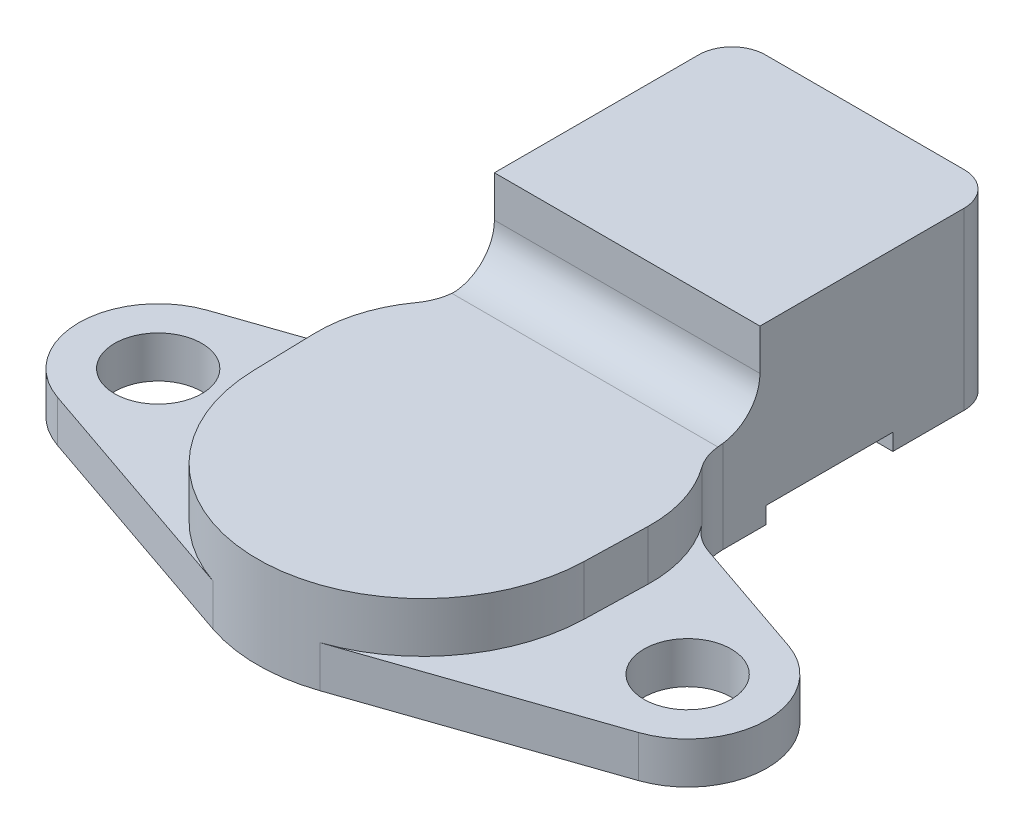
from build123d import *

# Parameters (mm, degrees)
BOSS_EXTRUDE1_DEPTH   = 1
SKETCH3_R             = 2.6162
BOSS_EXTRUDE1_2_DEPTH = 1
SKETCH4_R             = 2.6162
BOSS_EXTRUDE2_DEPTH   = 1.5
BOSS_EXTRUDE3_DEPTH   = 3
SKETCH6_W             = 15.9258
SKETCH6_H             = 13.25
BOSS_EXTRUDE4_DEPTH   = 5
SKETCH7_W             = 13.5128
SKETCH7_H             = 10
CUT_EXTRUDE1_DEPTH    = 5
FILLET1_R             = 2.54
FILLET2_R             = 2.54
FILLET3_R             = 7.62
FILLET5_R             = 2.54
SKETCH8_W             = 15.9258
SKETCH8_H             = 10.5
CUT_EXTRUDE2_DEPTH    = 3
BOSS_EXTRUDE5_DEPTH   = 4
SKETCH10_W            = 0.6964
SKETCH10_H            = 7.5
BOSS_EXTRUDE6_DEPTH   = 2
FILLET8_R             = 2


with BuildPart() as part:
    # Sketch3 → Boss-Extrude1 (new body)
    with BuildSketch(Plane(origin=(0, 0, 0), x_dir=(1, 0, 0), z_dir=(0, 1, 0))):
        Polygon((6.7564, 24.25), (6.7564, 20.22), (7.9629, 20.22), (7.9629, 25.5), (-7.9629, 25.5), (-7.9629, 20.22), (-6.7564, 20.22), (-6.7564, 24.25), align=None)
    extrude(amount=BOSS_EXTRUDE1_DEPTH)



with BuildPart() as body_2:
    # Sketch3 → Boss-Extrude1 2 (new body)
    with BuildSketch(Plane(origin=(0, 0, 0), x_dir=(1, 0, 0), z_dir=(0, 1, 0))):
        with BuildLine():
            Line((6.7564, 12.6), (6.7564, 4.876812672))
            ThreePointArc((6.7564, 4.876812672), (6.776225919, 4.847421317), (6.796505263, 4.818340964))
            ThreePointArc((6.796505263, 4.818340964), (0, -8.3312), (-6.796505263, 4.818340964))
            ThreePointArc((-6.796505263, 4.818340964), (-6.776225919, 4.847421317), (-6.7564, 4.876812672))
            Line((-6.7564, 4.876812672), (-6.7564, 12.6))
            Line((-6.7564, 12.6), (-7.9629, 12.6))
            Line((-7.9629, 12.6), (-7.9629, 10.019330915))
            ThreePointArc((-7.9629, 10.019330915), (-8.553832276, 8.174549356), (-10.10666, 7.016470768))
            Line((-10.10666, 7.016470768), (-17.42186, 4.50429022))
            ThreePointArc((-17.42186, 4.50429022), (-20.6375, 0), (-17.42186, -4.50429022))
            Line((-17.42186, -4.50429022), (-3.22159376, -9.380935099))
            ThreePointArc((-3.22159376, -9.380935099), (0, -9.9187), (3.22159376, -9.380935099))
            Line((3.22159376, -9.380935099), (17.42186, -4.50429022))
            ThreePointArc((17.42186, -4.50429022), (20.6375, 0), (17.42186, 4.50429022))
            Line((17.42186, 4.50429022), (10.10666, 7.016470768))
            ThreePointArc((10.10666, 7.016470768), (8.553832276, 8.174549356), (7.9629, 10.019330915))
            Line((7.9629, 10.019330915), (7.9629, 12.6))
            Line((7.9629, 12.6), (6.7564, 12.6))
        make_face()
        with Locations(Location((-15.875, 0, 0), (0, 0, 270))):
            Circle(SKETCH3_R, mode=Mode.SUBTRACT)
        with Locations(Location((15.875, 0, 0), (0, 0, 270))):
            Circle(SKETCH3_R, mode=Mode.SUBTRACT)
    extrude(amount=BOSS_EXTRUDE1_2_DEPTH)


with BuildPart() as part_1:
    add(part.part)

    add(body_2.part)  # Boss-Extrude2 merges body 2
    # Sketch4 → Boss-Extrude2 (add)
    with BuildSketch(Plane(origin=(0, 1, 0), x_dir=(1, 0, 0), z_dir=(0, 1, 0))):
        with BuildLine():
            Line((7.9629, 20.22), (7.9629, 25.5))
            Line((7.9629, 25.5), (-7.9629, 25.5))
            Line((-7.9629, 25.5), (-7.9629, 20.22))
            Line((-7.9629, 20.22), (-7.9629, 12.6))
            Line((-7.9629, 12.6), (-7.9629, 10.019330915))
            ThreePointArc((-7.9629, 10.019330915), (-8.553832276, 8.174549356), (-10.10666, 7.016470768))
            Line((-10.10666, 7.016470768), (-17.42186, 4.50429022))
            ThreePointArc((-17.42186, 4.50429022), (-20.6375, 0), (-17.42186, -4.50429022))
            Line((-17.42186, -4.50429022), (-3.22159376, -9.380935099))
            ThreePointArc((-3.22159376, -9.380935099), (0, -9.9187), (3.22159376, -9.380935099))
            Line((3.22159376, -9.380935099), (17.42186, -4.50429022))
            ThreePointArc((17.42186, -4.50429022), (20.6375, 0), (17.42186, 4.50429022))
            Line((17.42186, 4.50429022), (10.10666, 7.016470768))
            ThreePointArc((10.10666, 7.016470768), (8.553832276, 8.174549356), (7.9629, 10.019330915))
            Line((7.9629, 10.019330915), (7.9629, 12.6))
            Line((7.9629, 12.6), (7.9629, 20.22))
        make_face()
        with Locations(Location((15.875, 0, 0), (0, 0, 270))):
            Circle(SKETCH4_R, mode=Mode.SUBTRACT)
        with Locations(Location((-15.875, 0, 0), (0, 0, 270))):
            Circle(SKETCH4_R, mode=Mode.SUBTRACT)
        with BuildLine():
            Line((-6.7564, 24.25), (6.7564, 24.25))
            Line((6.7564, 24.25), (6.7564, 20.22))
            Line((6.7564, 20.22), (6.7564, 12.6))
            Line((6.7564, 12.6), (6.7564, 4.876812672))
            ThreePointArc((6.7564, 4.876812672), (6.776225919, 4.847421317), (6.796505263, 4.818340964))
            ThreePointArc((6.796505263, 4.818340964), (0, -8.3312), (-6.796505263, 4.818340964))
            ThreePointArc((-6.796505263, 4.818340964), (-6.776225919, 4.847421317), (-6.7564, 4.876812672))
            Line((-6.7564, 4.876812672), (-6.7564, 12.6))
            Line((-6.7564, 12.6), (-6.7564, 20.22))
            Line((-6.7564, 20.22), (-6.7564, 24.25))
        make_face(mode=Mode.SUBTRACT)
    extrude(amount=BOSS_EXTRUDE2_DEPTH)

    # Sketch5 → Boss-Extrude3 (add)
    # profile 1 of 2: a face of its own
    with BuildSketch(Plane(origin=(0, 2.5, 0), x_dir=(1, 0, 0), z_dir=(0, 1, 0))):
        with BuildLine():
            Line((-10.10666, 7.016470768), (-9.91527155, -0.260767662))
            ThreePointArc((-9.91527155, -0.260767662), (-7.996166023, -5.868725468), (-3.22159376, -9.380935099))
            ThreePointArc((-3.22159376, -9.380935099), (0, -9.9187), (3.22159376, -9.380935099))
            ThreePointArc((3.22159376, -9.380935099), (7.996166023, -5.868725468), (9.91527155, -0.260767662))
            Line((9.91527155, -0.260767662), (10.10666, 7.016470768))
            ThreePointArc((10.10666, 7.016470768), (8.553832276, 8.174549356), (7.9629, 10.019330915))
            Line((7.9629, 10.019330915), (7.9629, 25.5))
            Line((7.9629, 25.5), (-7.9629, 25.5))
            Line((-7.9629, 25.5), (-7.9629, 10.019330915))
            ThreePointArc((-7.9629, 10.019330915), (-8.553832276, 8.174549356), (-10.10666, 7.016470768))
        make_face()
        with BuildLine():
            Line((-6.7564, 4.876812672), (-6.7564, 24.25))
            Line((-6.7564, 24.25), (6.7564, 24.25))
            Line((6.7564, 24.25), (6.7564, 4.876812672))
            ThreePointArc((6.7564, 4.876812672), (6.776225919, 4.847421317), (6.796505263, 4.818340964))
            ThreePointArc((6.796505263, 4.818340964), (0, -8.3312), (-6.796505263, 4.818340964))
            ThreePointArc((-6.796505263, 4.818340964), (-6.776225919, 4.847421317), (-6.7564, 4.876812672))
        make_face(mode=Mode.SUBTRACT)
    # profile 2 of 2: a face of its own
    with BuildSketch(Plane(origin=(0, 2.5, 0), x_dir=(1, 0, 0), z_dir=(0, 1, 0))):
        with BuildLine():
            ThreePointArc((-6.796505263, 4.818340964), (-6.776225919, 4.847421317), (-6.7564, 4.876812672))
            Line((-6.7564, 4.876812672), (-6.7564, 24.25))
            Line((-6.7564, 24.25), (6.7564, 24.25))
            Line((6.7564, 24.25), (6.7564, 4.876812672))
            ThreePointArc((6.7564, 4.876812672), (6.776225919, 4.847421317), (6.796505263, 4.818340964))
            ThreePointArc((6.796505263, 4.818340964), (0, -8.3312), (-6.796505263, 4.818340964))
        make_face()
    extrude(amount=BOSS_EXTRUDE3_DEPTH)

    # Sketch6 → Boss-Extrude4 (add)
    with BuildSketch(Plane(origin=(0, 5.5, 0), x_dir=(1, 0, 0), z_dir=(0, 1, 0))):
        with Locations((0, 18.875)):
            Rectangle(SKETCH6_W, SKETCH6_H)
    extrude(amount=BOSS_EXTRUDE4_DEPTH)

    # Sketch7 → Cut-Extrude1 (cut)
    with BuildSketch(Plane.XZ.offset(-2.5)):
        with Locations((0, -19.25)):
            Rectangle(SKETCH7_W, SKETCH7_H)
    extrude(amount=-CUT_EXTRUDE1_DEPTH, mode=Mode.SUBTRACT)

    # Fillet1
    fillet1_edges = [part_1.edges().sort_by_distance(p)[0] for p in [
        (-6.7564, 1.25, -4.876812672),
    ]]
    fillet(fillet1_edges, radius=FILLET1_R)

    # Fillet2
    fillet2_edges = [part_1.edges().sort_by_distance(p)[0] for p in [
        (6.7564, 1.25, -4.876812672),
    ]]
    fillet(fillet2_edges, radius=FILLET2_R)

    # Fillet3
    fillet3_edges = [part_1.edges().sort_by_distance(p)[0] for p in [
        (10.10666, 4, -7.016470768),
        (-10.10666, 4, -7.016470768),
    ]]
    fillet(fillet3_edges, radius=FILLET3_R)

    # Fillet5
    fillet5_edges = [part_1.edges().sort_by_distance(p)[0] for p in [
        (0, 5.5, -12.25),
    ]]
    fillet(fillet5_edges, radius=FILLET5_R)

    # Sketch8 → Cut-Extrude2 (cut)
    with BuildSketch(Plane(origin=(0, 0, -25.5), x_dir=(-1, 0, 0), z_dir=(0, 0, -1))):
        with Locations((0, 5.25)):
            Rectangle(SKETCH8_W, SKETCH8_H)
    extrude(amount=-CUT_EXTRUDE2_DEPTH, mode=Mode.SUBTRACT)

    # Sketch9 → Boss-Extrude5 (add)
    with BuildSketch(Plane(origin=(0, 0, -22.5), x_dir=(-1, 0, 0), z_dir=(0, 0, -1))):
        Polygon((-6.7564, 0), (-6.7564, 7.5), (6.7564, 7.5), (6.7564, 0), (7.9629, 0), (7.9629, 10.5), (-7.9629, 10.5), (-7.9629, 0), align=None)
    extrude(amount=BOSS_EXTRUDE5_DEPTH)

    # Sketch10 → Boss-Extrude6 (add)
    with BuildSketch(Plane(origin=(0, 0, -26.5), x_dir=(-1, 0, 0), z_dir=(0, 0, -1))):
        with Locations((-6.4082, 3.75)):
            Rectangle(SKETCH10_W, SKETCH10_H)
        with Locations((6.4082, 3.75)):
            Rectangle(SKETCH10_W, SKETCH10_H)
    extrude(amount=-BOSS_EXTRUDE6_DEPTH)

    # Fillet8
    fillet8_edges = [part_1.edges().sort_by_distance(p)[0] for p in [
        (-7.9629, 5.25, -26.5),
        (7.9629, 5.25, -26.5),
    ]]
    fillet(fillet8_edges, radius=FILLET8_R)


solid = part_1.part
